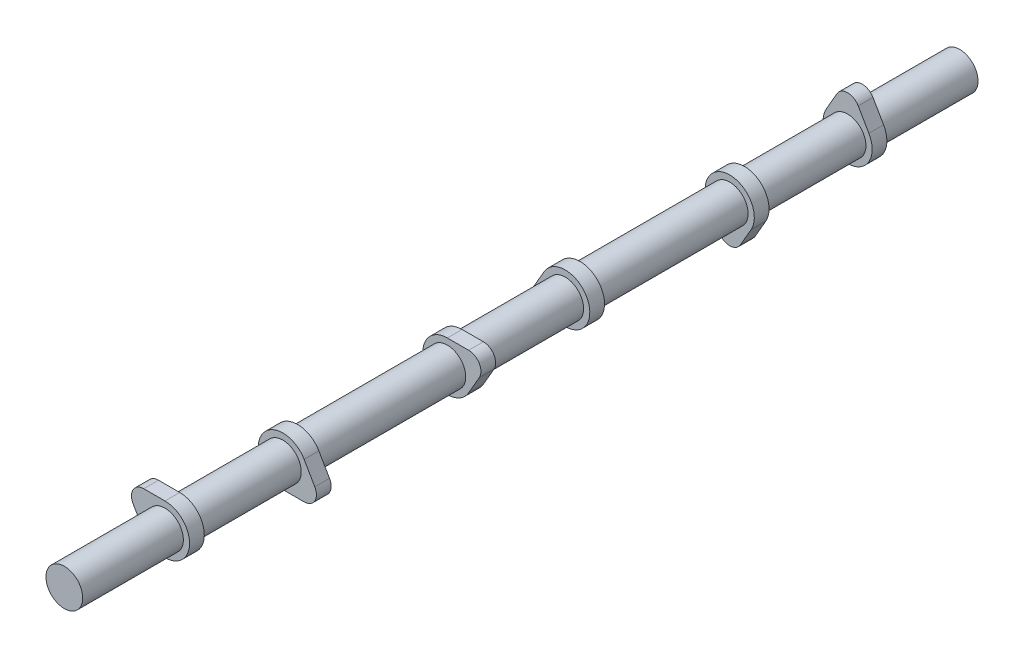
from build123d import *

# Parameters (mm, degrees)
BOSS_EXTRUDE1_DEPTH   = 7.62
BODY_MOVE_COPY5_ANGLE = 180
BOSS_EXTRUDE2_START   = -25.4
SKETCH4_R             = 9.5
BOSS_EXTRUDE2_DEPTH   = 146.05
LPATTERN2_COUNT       = 3
LPATTERN2_PITCH       = 146.05
BODY_MOVE_COPY6_ANGLE = 120
BODY_MOVE_COPY7_ANGLE = 120
BOSS_EXTRUDE3_START   = 24.94
SKETCH6_R             = 9.5
BOSS_EXTRUDE3_DEPTH   = 24.94


with BuildPart() as part:
    # Sketch2 → Boss-Extrude1 (new body)
    with BuildSketch(Plane.XY):
        with BuildLine():
            Line((-10.998522628, 6.35), (-5.499261314, 15.875))
            ThreePointArc((-5.499261314, 15.875), (0, 19.05), (5.499261314, 15.875))
            Line((5.499261314, 15.875), (10.998522628, 6.35))
            ThreePointArc((10.998522628, 6.35), (0, -12.7), (-10.998522628, 6.35))
        make_face()
    extrude(amount=BOSS_EXTRUDE1_DEPTH)


with BuildPart() as body_2:
    # Body-Move/Copy4: copy of part
    add(part.part.moved(Location((0, 0, 60.96))))


with BuildPart() as body_2_1:
    # Body-Move/Copy5: moved
    add(body_2.part.rotate(Axis((0, 0, 0), (0, 0, 1)), BODY_MOVE_COPY5_ANGLE))


with BuildPart() as part_1:
    add(part.part)

    add(body_2_1.part)  # Boss-Extrude2 merges body 2
    # Sketch4 → Boss-Extrude2 (add)
    with BuildSketch(Plane.XY.offset(BOSS_EXTRUDE2_START)):
        Circle(SKETCH4_R)
    extrude(amount=BOSS_EXTRUDE2_DEPTH)


with BuildPart() as lpattern2_1:
    # LPattern2: pattern copy
    add(part_1.part.moved(Location(Vector(0, 0, 1) * (1 * LPATTERN2_PITCH))))


with BuildPart() as lpattern2_2:
    # LPattern2: pattern copy
    add(part_1.part.moved(Location(Vector(0, 0, 1) * (2 * LPATTERN2_PITCH))))


with BuildPart() as lpattern2_1_1:
    # Body-Move/Copy6: moved
    add(lpattern2_1.part.rotate(Axis((0, 0, 0), (0, 0, 1)), BODY_MOVE_COPY6_ANGLE))


with BuildPart() as lpattern2_2_1:
    # Body-Move/Copy7: moved
    add(lpattern2_2.part.rotate(Axis((0, 0, 0), (0, 0, -1)), BODY_MOVE_COPY7_ANGLE))


with BuildPart() as part_2:
    add(part_1.part)

    # Sketch6 → Boss-Extrude3 (add)
    with BuildSketch(Plane(origin=(0, 0, -25.4), x_dir=(-1, 0, 0), z_dir=(0, 0, -1)).offset(BOSS_EXTRUDE3_START)):
        Circle(SKETCH6_R)
    extrude(amount=-BOSS_EXTRUDE3_DEPTH)

    # Combine1: union LPattern2_1, LPattern2_2
    add(lpattern2_1_1.part)
    add(lpattern2_2_1.part)


solid = part_2.part
